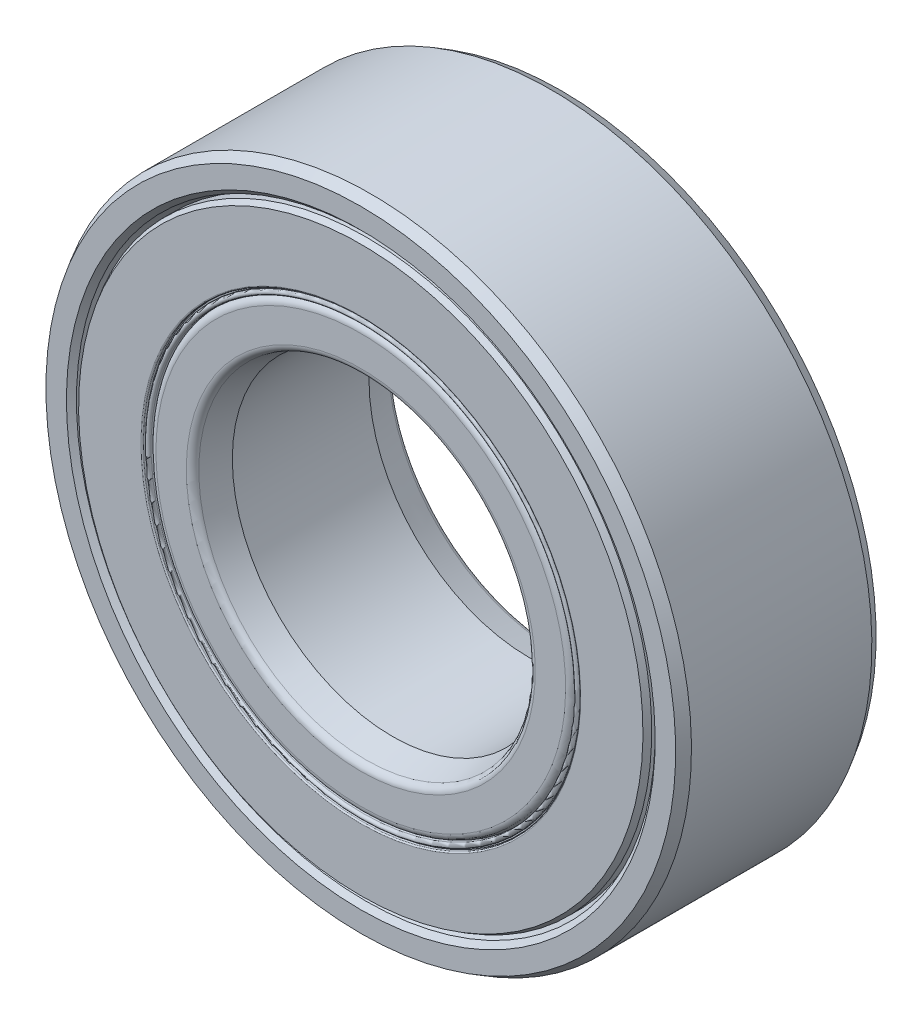
from build123d import *

# Parameters (mm, degrees)
CIRPATTERN1_COUNT = 9


with BuildPart() as part:
    # Sketch3 → Revolve1 (revolve)
    with BuildSketch(Plane(origin=(0, 0, 0), x_dir=(0, 0, -1), z_dir=(1, 0, 0)), mode=Mode.PRIVATE) as revolve1_sk:
        with BuildLine():
            Line((-2.103734106, 7.12), (-2.375, 7.218732711))
            Line((-2.375, 7.218732711), (-2.5, 7.343732711))
            Line((-2.5, 7.343732711), (-2.5, 7.855662433))
            Line((-2.5, 7.855662433), (-2.25, 8))
            Line((-2.25, 8), (2.25, 8))
            Line((2.25, 8), (2.5, 7.855662433))
            Line((2.5, 7.855662433), (2.5, 7.343732711))
            Line((2.5, 7.343732711), (2.375, 7.218732711))
            Line((2.375, 7.218732711), (2.103734106, 7.12))
            Line((2.103734106, 7.12), (1.189883281, 7.12))
            ThreePointArc((1.189883281, 7.12), (0, 7.706666667), (-1.189883281, 7.12))
            Line((-1.189883281, 7.12), (-2.103734106, 7.12))
        make_face()
    revolve(revolve1_sk.sketch.rotate(Axis((0, 0, 2.5), (0, 0, -1)), 180), axis=Axis((0, 0, 2.5), (0, 0, -1)))


with BuildPart() as body_2:
    # Sketch4 → Revolve2 (revolve)
    with BuildSketch(Plane(origin=(0, 0, 0), x_dir=(0, 0, -1), z_dir=(1, 0, 0)), mode=Mode.PRIVATE) as revolve2_sk:
        with BuildLine():
            Line((-1.705109923, 4), (-2.364438899, 4.176666667))
            ThreePointArc((-2.364438899, 4.176666667), (-2.462204576, 4.241991603), (-2.5, 4.353333333))
            Line((-2.5, 4.353333333), (-2.5, 5.110434541))
            ThreePointArc((-2.5, 5.110434541), (-2.446430184, 5.239763517), (-2.317101208, 5.293333333))
            Line((-2.317101208, 5.293333333), (-1.189883281, 5.293333333))
            ThreePointArc((-1.189883281, 5.293333333), (0, 4.706666667), (1.189883281, 5.293333333))
            Line((1.189883281, 5.293333333), (2.317101208, 5.293333333))
            ThreePointArc((2.317101208, 5.293333333), (2.446430184, 5.239763517), (2.5, 5.110434541))
            Line((2.5, 5.110434541), (2.5, 4.353333333))
            ThreePointArc((2.5, 4.353333333), (2.462204576, 4.241991603), (2.364438899, 4.176666667))
            Line((2.364438899, 4.176666667), (1.705109923, 4))
            Line((1.705109923, 4), (-1.705109923, 4))
        make_face()
    revolve(revolve2_sk.sketch.rotate(Axis((0, 0, 2.5), (0, 0, -1)), 180), axis=Axis((0, 0, 2.5), (0, 0, -1)))


with BuildPart() as body_3:
    # Sketch5 → Revolve3 (revolve)
    with BuildSketch(Plane(origin=(0, 0, 0), x_dir=(0, 0, -1), z_dir=(1, 0, 0))):
        with BuildLine():
            Line((-1.5, 6.206666667), (1.5, 6.206666667))
            ThreePointArc((1.5, 6.206666667), (0, 7.706666667), (-1.5, 6.206666667))
        make_face()
    revolve(axis=Axis((0, 6.206666667, 1.5), (0, 0, -1)))


with BuildPart() as cirpattern1_1:
    # CirPattern1: pattern copy
    add(body_3.part.rotate(Axis((0, 0, 0), (0, 0, 1)), 1 * 360 / CIRPATTERN1_COUNT))


with BuildPart() as cirpattern1_2:
    # CirPattern1: pattern copy
    add(body_3.part.rotate(Axis((0, 0, 0), (0, 0, 1)), 2 * 360 / CIRPATTERN1_COUNT))


with BuildPart() as cirpattern1_3:
    # CirPattern1: pattern copy
    add(body_3.part.rotate(Axis((0, 0, 0), (0, 0, 1)), 3 * 360 / CIRPATTERN1_COUNT))


with BuildPart() as cirpattern1_4:
    # CirPattern1: pattern copy
    add(body_3.part.rotate(Axis((0, 0, 0), (0, 0, 1)), 4 * 360 / CIRPATTERN1_COUNT))


with BuildPart() as cirpattern1_5:
    # CirPattern1: pattern copy
    add(body_3.part.rotate(Axis((0, 0, 0), (0, 0, 1)), 5 * 360 / CIRPATTERN1_COUNT))


with BuildPart() as cirpattern1_6:
    # CirPattern1: pattern copy
    add(body_3.part.rotate(Axis((0, 0, 0), (0, 0, 1)), 6 * 360 / CIRPATTERN1_COUNT))


with BuildPart() as cirpattern1_7:
    # CirPattern1: pattern copy
    add(body_3.part.rotate(Axis((0, 0, 0), (0, 0, 1)), 7 * 360 / CIRPATTERN1_COUNT))


with BuildPart() as cirpattern1_8:
    # CirPattern1: pattern copy
    add(body_3.part.rotate(Axis((0, 0, 0), (0, 0, 1)), 8 * 360 / CIRPATTERN1_COUNT))


with BuildPart() as body_12:
    # Sketch6 → Revolve4 (revolve)
    with BuildSketch(Plane(origin=(0, 0, 0), x_dir=(0, 0, -1), z_dir=(1, 0, 0)), mode=Mode.PRIVATE) as revolve4_sk:
        with BuildLine():
            Line((-2.361435935, 7.12), (-1.5, 7.12))
            Line((-1.5, 7.12), (-1.5, 5.453333333))
            Line((-1.5, 5.453333333), (-2.468, 5.453333333))
            ThreePointArc((-2.468, 5.453333333), (-2.490627417, 5.462705916), (-2.5, 5.485333333))
            Line((-2.5, 5.485333333), (-2.5, 7.04))
            Line((-2.5, 7.04), (-2.361435935, 7.12))
        make_face()
        with BuildLine():
            Line((2.468, 5.453333333), (1.5, 5.453333333))
            Line((1.5, 5.453333333), (1.5, 7.12))
            Line((1.5, 7.12), (2.361435935, 7.12))
            Line((2.361435935, 7.12), (2.5, 7.04))
            Line((2.5, 7.04), (2.5, 5.485333333))
            ThreePointArc((2.5, 5.485333333), (2.490627417, 5.462705916), (2.468, 5.453333333))
        make_face()
    revolve(revolve4_sk.sketch.rotate(Axis((0, 0, 2.5), (0, 0, -1)), 180), axis=Axis((0, 0, 2.5), (0, 0, -1)))


with BuildPart() as body_13:
    # Sketch7 → Revolve5 (revolve)
    with BuildSketch(Plane(origin=(0, 0, 0), x_dir=(0, 0, -1), z_dir=(1, 0, 0)), mode=Mode.PRIVATE) as revolve5_sk:
        with BuildLine():
            Line((-1.5, 5.453333333), (-2.378499547, 5.453333333))
            Line((-2.378499547, 5.453333333), (-2.417891857, 5.446387406))
            ThreePointArc((-2.417891857, 5.446387406), (-2.431590167, 5.428535421), (-2.415, 5.413333333))
            Line((-2.415, 5.413333333), (-2.44, 5.413333333))
            ThreePointArc((-2.44, 5.413333333), (-2.5, 5.353333333), (-2.44, 5.293333333))
            Line((-2.44, 5.293333333), (-1.5, 5.293333333))
            Line((-1.5, 5.293333333), (-1.5, 5.453333333))
        make_face()
    revolve(revolve5_sk.sketch.rotate(Axis((0, 0, 2.5), (0, 0, -1)), 180), axis=Axis((0, 0, 2.5), (0, 0, -1)))


solid = Compound([part.part, body_2.part, body_3.part, cirpattern1_1.part, cirpattern1_2.part, cirpattern1_3.part, cirpattern1_4.part, cirpattern1_5.part, cirpattern1_6.part, cirpattern1_7.part, cirpattern1_8.part, body_12.part, body_13.part])
